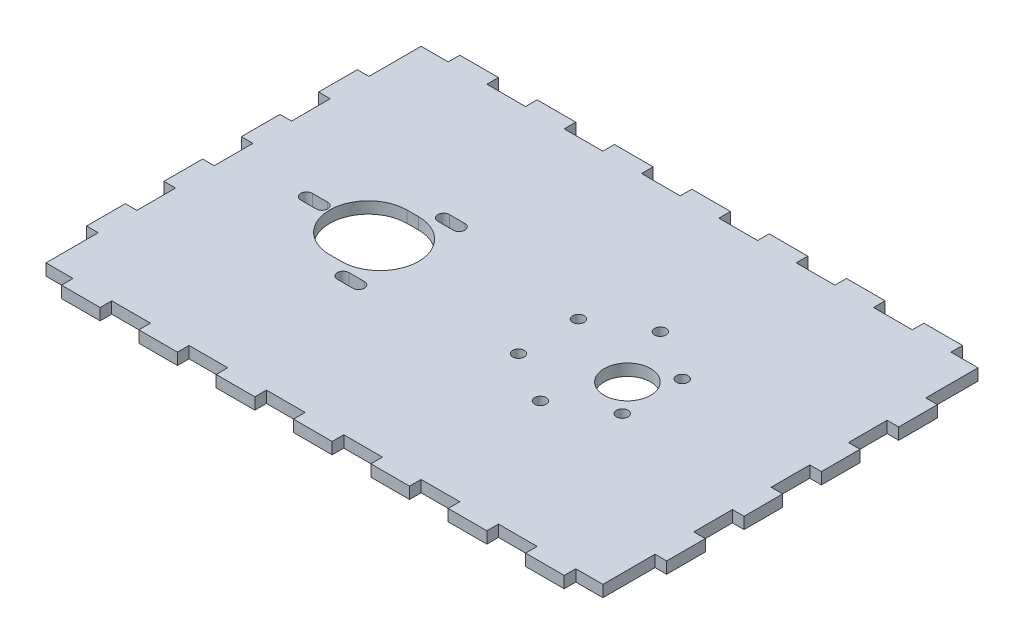
from build123d import *

# Parameters (mm, degrees)
SKETCH1_W                 = 150
SKETCH1_H                 = 103
BOSS_EXTRUDE1_DEPTH       = 3
SKETCH2_W                 = 10
SKETCH2_H                 = 3
CUT_EXTRUDE1_DEPTH        = 92.028841583
LPATTERN1_COUNT           = 8
LPATTERN1_PITCH           = 20
MIRROR1_COPY_1_SKETCH_W   = 10
MIRROR1_COPY_1_SKETCH_H   = 3
MIRROR1_COPY_1_DEPTH      = 92.028841583
MIRROR1_COPY_2_SKETCH_W   = 10
MIRROR1_COPY_2_SKETCH_H   = 3
MIRROR1_COPY_2_DEPTH      = 92.028841583
MIRROR1_COPY_3_SKETCH_W   = 10
MIRROR1_COPY_3_SKETCH_H   = 3
MIRROR1_COPY_3_DEPTH      = 92.028841583
MIRROR1_COPY_4_SKETCH_W   = 10
MIRROR1_COPY_4_SKETCH_H   = 3
MIRROR1_COPY_4_DEPTH      = 92.028841583
MIRROR1_COPY_5_SKETCH_W   = 10
MIRROR1_COPY_5_SKETCH_H   = 3
MIRROR1_COPY_5_DEPTH      = 92.028841583
MIRROR1_COPY_6_SKETCH_W   = 10
MIRROR1_COPY_6_SKETCH_H   = 3
MIRROR1_COPY_6_DEPTH      = 92.028841583
MIRROR1_COPY_7_SKETCH_W   = 10
MIRROR1_COPY_7_SKETCH_H   = 3
MIRROR1_COPY_7_DEPTH      = 92.028841583
SKETCH3_W                 = 3
SKETCH3_H                 = 10
CUT_EXTRUDE2_DEPTH        = 92.028841583
LPATTERN2_COUNT           = 5
LPATTERN2_PITCH           = 20
MIRROR2_COPY_1_SKETCH_W   = 3
MIRROR2_COPY_1_SKETCH_H   = 10
MIRROR2_COPY_1_DEPTH      = 92.028841583
MIRROR2_COPY_2_SKETCH_W   = 3
MIRROR2_COPY_2_SKETCH_H   = 10
MIRROR2_COPY_2_DEPTH      = 92.028841583
MIRROR2_COPY_3_SKETCH_W   = 3
MIRROR2_COPY_3_SKETCH_H   = 10
MIRROR2_COPY_3_DEPTH      = 92.028841583
MIRROR2_COPY_4_SKETCH_W   = 3
MIRROR2_COPY_4_SKETCH_H   = 10
MIRROR2_COPY_4_DEPTH      = 92.028841583
SKETCH4_W                 = 3
SKETCH4_H                 = 3.5
CUT_EXTRUDE3_DEPTH        = 92.028841583
SKETCH7_R                 = 6
SKETCH7_R_2               = 1.5
CUT_EXTRUDE4_DEPTH        = 92.028841583
M3X0_5_TAPPED_HOLE3_D     = 3
M3X0_5_TAPPED_HOLE3_DEPTH = 10
M3X0_5_TAPPED_HOLE3_TIP   = 0.901290929


with BuildPart() as part:
    # Sketch1 → Boss-Extrude1 (new body)
    with BuildSketch(Plane(origin=(0, 0, 0), x_dir=(1, 0, 0), z_dir=(0, 1, 0))):
        Rectangle(SKETCH1_W, SKETCH1_H)
    extrude(amount=BOSS_EXTRUDE1_DEPTH)

    # Sketch2 → Cut-Extrude1 (cut, through all)
    with BuildSketch(Plane(origin=(0, 3, 0), x_dir=(1, 0, 0), z_dir=(0, 1, 0))):
        with Locations((70, -50)):
            Rectangle(SKETCH2_W, SKETCH2_H)
    cut_extrude1 = extrude(amount=-CUT_EXTRUDE1_DEPTH, mode=Mode.SUBTRACT)

    # LPattern1: Cut-Extrude1 ×8
    with Locations(*[(-i * LPATTERN1_PITCH, 0, 0) for i in range(1, LPATTERN1_COUNT)]):
        add(cut_extrude1, mode=Mode.SUBTRACT)

    # Mirror1: Cut-Extrude1 across plane
    add(cut_extrude1.mirror(Plane.XY), mode=Mode.SUBTRACT)

    # Mirror1 copy 1 sketch → Mirror1 copy 1 (cut, through all)
    with BuildSketch(Plane(origin=(-20, 3, 0), x_dir=(1, 0, 0), z_dir=(0, 1, 0))):
        with Locations((70, 50)):
            Rectangle(MIRROR1_COPY_1_SKETCH_W, MIRROR1_COPY_1_SKETCH_H)
    extrude(amount=-MIRROR1_COPY_1_DEPTH, mode=Mode.SUBTRACT)

    # Mirror1 copy 2 sketch → Mirror1 copy 2 (cut, through all)
    with BuildSketch(Plane(origin=(-40, 3, 0), x_dir=(1, 0, 0), z_dir=(0, 1, 0))):
        with Locations((70, 50)):
            Rectangle(MIRROR1_COPY_2_SKETCH_W, MIRROR1_COPY_2_SKETCH_H)
    extrude(amount=-MIRROR1_COPY_2_DEPTH, mode=Mode.SUBTRACT)

    # Mirror1 copy 3 sketch → Mirror1 copy 3 (cut, through all)
    with BuildSketch(Plane(origin=(-60, 3, 0), x_dir=(1, 0, 0), z_dir=(0, 1, 0))):
        with Locations((70, 50)):
            Rectangle(MIRROR1_COPY_3_SKETCH_W, MIRROR1_COPY_3_SKETCH_H)
    extrude(amount=-MIRROR1_COPY_3_DEPTH, mode=Mode.SUBTRACT)

    # Mirror1 copy 4 sketch → Mirror1 copy 4 (cut, through all)
    with BuildSketch(Plane(origin=(-80, 3, 0), x_dir=(1, 0, 0), z_dir=(0, 1, 0))):
        with Locations((70, 50)):
            Rectangle(MIRROR1_COPY_4_SKETCH_W, MIRROR1_COPY_4_SKETCH_H)
    extrude(amount=-MIRROR1_COPY_4_DEPTH, mode=Mode.SUBTRACT)

    # Mirror1 copy 5 sketch → Mirror1 copy 5 (cut, through all)
    with BuildSketch(Plane(origin=(-100, 3, 0), x_dir=(1, 0, 0), z_dir=(0, 1, 0))):
        with Locations((70, 50)):
            Rectangle(MIRROR1_COPY_5_SKETCH_W, MIRROR1_COPY_5_SKETCH_H)
    extrude(amount=-MIRROR1_COPY_5_DEPTH, mode=Mode.SUBTRACT)

    # Mirror1 copy 6 sketch → Mirror1 copy 6 (cut, through all)
    with BuildSketch(Plane(origin=(-120, 3, 0), x_dir=(1, 0, 0), z_dir=(0, 1, 0))):
        with Locations((70, 50)):
            Rectangle(MIRROR1_COPY_6_SKETCH_W, MIRROR1_COPY_6_SKETCH_H)
    extrude(amount=-MIRROR1_COPY_6_DEPTH, mode=Mode.SUBTRACT)

    # Mirror1 copy 7 sketch → Mirror1 copy 7 (cut, through all)
    with BuildSketch(Plane(origin=(-140, 3, 0), x_dir=(1, 0, 0), z_dir=(0, 1, 0))):
        with Locations((70, 50)):
            Rectangle(MIRROR1_COPY_7_SKETCH_W, MIRROR1_COPY_7_SKETCH_H)
    extrude(amount=-MIRROR1_COPY_7_DEPTH, mode=Mode.SUBTRACT)

    # Sketch3 → Cut-Extrude2 (cut, through all)
    with BuildSketch(Plane(origin=(0, 3, 0), x_dir=(1, 0, 0), z_dir=(0, 1, 0))):
        with Locations((73.5, 40)):
            Rectangle(SKETCH3_W, SKETCH3_H)
    cut_extrude2 = extrude(amount=-CUT_EXTRUDE2_DEPTH, mode=Mode.SUBTRACT)

    # LPattern2: Cut-Extrude2 ×5
    with Locations(*[(0, 0, i * LPATTERN2_PITCH) for i in range(1, LPATTERN2_COUNT)]):
        add(cut_extrude2, mode=Mode.SUBTRACT)

    # Mirror2: Cut-Extrude2 across plane
    add(cut_extrude2.mirror(Plane(origin=(0, 0, 0), x_dir=(0, 0, 1), z_dir=(1, 0, 0))), mode=Mode.SUBTRACT)

    # Mirror2 copy 1 sketch → Mirror2 copy 1 (cut, through all)
    with BuildSketch(Plane(origin=(0, 3, 20), x_dir=(-1, 0, 0), z_dir=(0, 1, 0))):
        with Locations((73.5, -40)):
            Rectangle(MIRROR2_COPY_1_SKETCH_W, MIRROR2_COPY_1_SKETCH_H)
    extrude(amount=-MIRROR2_COPY_1_DEPTH, mode=Mode.SUBTRACT)

    # Mirror2 copy 2 sketch → Mirror2 copy 2 (cut, through all)
    with BuildSketch(Plane(origin=(0, 3, 40), x_dir=(-1, 0, 0), z_dir=(0, 1, 0))):
        with Locations((73.5, -40)):
            Rectangle(MIRROR2_COPY_2_SKETCH_W, MIRROR2_COPY_2_SKETCH_H)
    extrude(amount=-MIRROR2_COPY_2_DEPTH, mode=Mode.SUBTRACT)

    # Mirror2 copy 3 sketch → Mirror2 copy 3 (cut, through all)
    with BuildSketch(Plane(origin=(0, 3, 60), x_dir=(-1, 0, 0), z_dir=(0, 1, 0))):
        with Locations((73.5, -40)):
            Rectangle(MIRROR2_COPY_3_SKETCH_W, MIRROR2_COPY_3_SKETCH_H)
    extrude(amount=-MIRROR2_COPY_3_DEPTH, mode=Mode.SUBTRACT)

    # Mirror2 copy 4 sketch → Mirror2 copy 4 (cut, through all)
    with BuildSketch(Plane(origin=(0, 3, 80), x_dir=(-1, 0, 0), z_dir=(0, 1, 0))):
        with Locations((73.5, -40)):
            Rectangle(MIRROR2_COPY_4_SKETCH_W, MIRROR2_COPY_4_SKETCH_H)
    extrude(amount=-MIRROR2_COPY_4_DEPTH, mode=Mode.SUBTRACT)

    # Sketch4 → Cut-Extrude3 (cut, through all)
    with BuildSketch(Plane(origin=(0, 3, 0), x_dir=(1, 0, 0), z_dir=(0, 1, 0))):
        with Locations((73.5, 46.75)):
            Rectangle(SKETCH4_W, SKETCH4_H)
        with Locations((-73.5, 46.75)):
            Rectangle(SKETCH4_W, SKETCH4_H)
        with Locations((-73.5, -46.75)):
            Rectangle(SKETCH4_W, SKETCH4_H)
        with Locations((73.5, -46.75)):
            Rectangle(SKETCH4_W, SKETCH4_H)
    extrude(amount=-CUT_EXTRUDE3_DEPTH, mode=Mode.SUBTRACT)

    # Sketch7 → Cut-Extrude4 (cut, through all)
    with BuildSketch(Plane(origin=(0, 3, 0), x_dir=(1, 0, 0), z_dir=(0, 1, 0))):
        with Locations(Location((29.848397993, 0, 0), (0, 0, 270))):
            Circle(SKETCH7_R)
        with Locations(Location((22.848397993, 15.5, 0), (0, 0, 270))):
            Circle(SKETCH7_R_2)
        with Locations(Location((36.271791752, 7.75, 0), (0, 0, 270))):
            Circle(SKETCH7_R_2)
        with Locations(Location((36.271791752, -7.75, 0), (0, 0, 270))):
            Circle(SKETCH7_R_2)
        with Locations(Location((22.848397993, -15.5, 0), (0, 0, 270))):
            Circle(SKETCH7_R_2)
        with Locations(Location((9.425004235, -7.75, 0), (0, 0, 270))):
            Circle(SKETCH7_R_2)
        with Locations(Location((9.425004235, 7.75, 0), (0, 0, 270))):
            Circle(SKETCH7_R_2)
        with BuildLine():
            Line((-34.151602007, -10), (-37.151602007, -10))
            ThreePointArc((-37.151602007, -10), (-47.151602007, 0), (-37.151602007, 10))
            Line((-37.151602007, 10), (-34.151602007, 10))
            ThreePointArc((-34.151602007, 10), (-24.151602007, 0), (-34.151602007, -10))
        make_face()
        with BuildLine():
            Line((-49.151602007, -1.5), (-53.151602007, -1.5))
            ThreePointArc((-53.151602007, -1.5), (-54.651602007, 0), (-53.151602007, 1.5))
            Line((-53.151602007, 1.5), (-49.151602007, 1.5))
            ThreePointArc((-49.151602007, 1.5), (-47.651602007, 0), (-49.151602007, -1.5))
        make_face()
        with BuildLine():
            Line((-26.651602007, 11.4685656), (-30.651602007, 11.4685656))
            ThreePointArc((-30.651602007, 11.4685656), (-32.151602007, 12.9685656), (-30.651602007, 14.4685656))
            Line((-30.651602007, 14.4685656), (-26.651602007, 14.4685656))
            ThreePointArc((-26.651602007, 14.4685656), (-25.151602007, 12.9685656), (-26.651602007, 11.4685656))
        make_face()
        with BuildLine():
            Line((-26.651602007, -14.512196514), (-30.651602007, -14.512196514))
            ThreePointArc((-30.651602007, -14.512196514), (-32.151602007, -13.012196514), (-30.651602007, -11.512196514))
            Line((-30.651602007, -11.512196514), (-26.651602007, -11.512196514))
            ThreePointArc((-26.651602007, -11.512196514), (-25.151602007, -13.012196514), (-26.651602007, -14.512196514))
        make_face()
    extrude(amount=-CUT_EXTRUDE4_DEPTH, mode=Mode.SUBTRACT)

    # M3x0.5 Tapped Hole3
    with Locations(Plane(origin=(0, 3, 0), x_dir=(1, 0, 0), z_dir=(0, 1, 0))):
        with Locations((22.848397993, 15.5), (36.271791752, -7.75), (22.848397993, -15.5), (9.425004235, -7.75), (9.425004235, 7.75), (36.271791752, 7.75)):
            Hole(M3X0_5_TAPPED_HOLE3_D / 2, depth=M3X0_5_TAPPED_HOLE3_DEPTH)
            with Locations((0, 0, -(M3X0_5_TAPPED_HOLE3_DEPTH + M3X0_5_TAPPED_HOLE3_TIP / 2))):  # 118° drill point
                Cone(0, M3X0_5_TAPPED_HOLE3_D / 2, M3X0_5_TAPPED_HOLE3_TIP, mode=Mode.SUBTRACT)


solid = part.part
